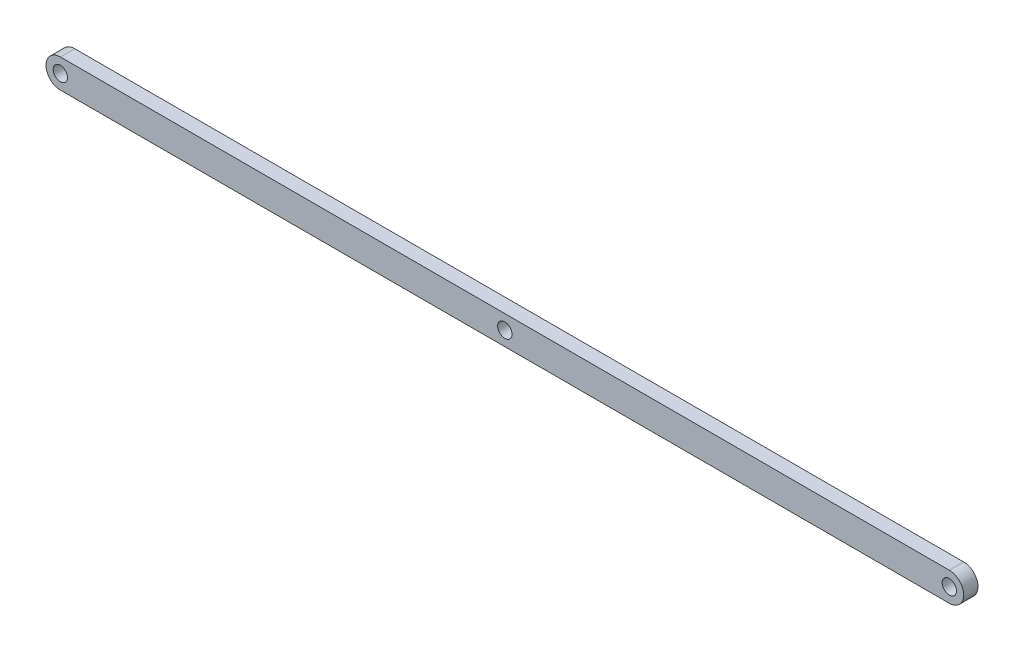
from build123d import *

# Parameters (mm, degrees)
SKETCH1_R           = 5
BOSS_EXTRUDE1_DEPTH = 10


with BuildPart() as part:
    # Sketch1 → Boss-Extrude1 (new body)
    with BuildSketch(Plane.XY):
        with BuildLine():
            Line((310, -10), (-310, -10))
            ThreePointArc((-310, -10), (-320, 0), (-310, 10))
            Line((-310, 10), (310, 10))
            ThreePointArc((310, 10), (320, 0), (310, -10))
        make_face()
        with Locations((-310, 0)):
            Circle(SKETCH1_R, mode=Mode.SUBTRACT)
        with Locations((310, 0)):
            Circle(SKETCH1_R, mode=Mode.SUBTRACT)
        Circle(SKETCH1_R, mode=Mode.SUBTRACT)
    extrude(amount=BOSS_EXTRUDE1_DEPTH)


solid = part.part
